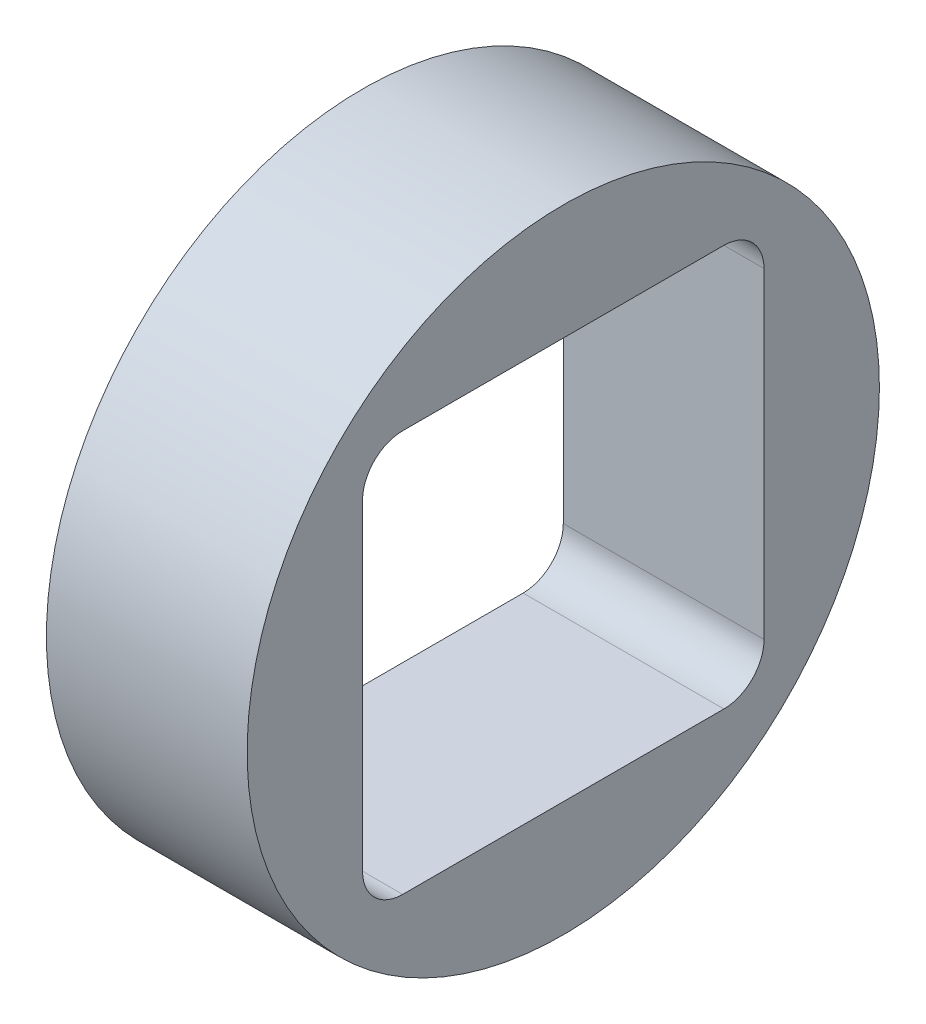
from build123d import *

# Parameters (mm, degrees)
SKETCH1_R           = 5
SKETCH1_W           = 6.35
SKETCH1_H           = 6.35
BOSS_EXTRUDE1_DEPTH = 3.175
FILLET1_R           = 0.635


with BuildPart() as part:
    # Sketch1 → Boss-Extrude1 (new body)
    with BuildSketch(Plane(origin=(0, 0, 0), x_dir=(0, 0, -1), z_dir=(1, 0, 0))):
        Circle(SKETCH1_R)
        Rectangle(SKETCH1_W, SKETCH1_H, mode=Mode.SUBTRACT)
    extrude(amount=BOSS_EXTRUDE1_DEPTH)

    # Fillet1
    fillet1_edges = [part.edges().sort_by_distance(p)[0] for p in [
        (1.5875, -3.175, 3.175),
        (1.5875, -3.175, -3.175),
        (1.5875, 3.175, -3.175),
        (1.5875, 3.175, 3.175),
    ]]
    fillet(fillet1_edges, radius=FILLET1_R)


solid = part.part
